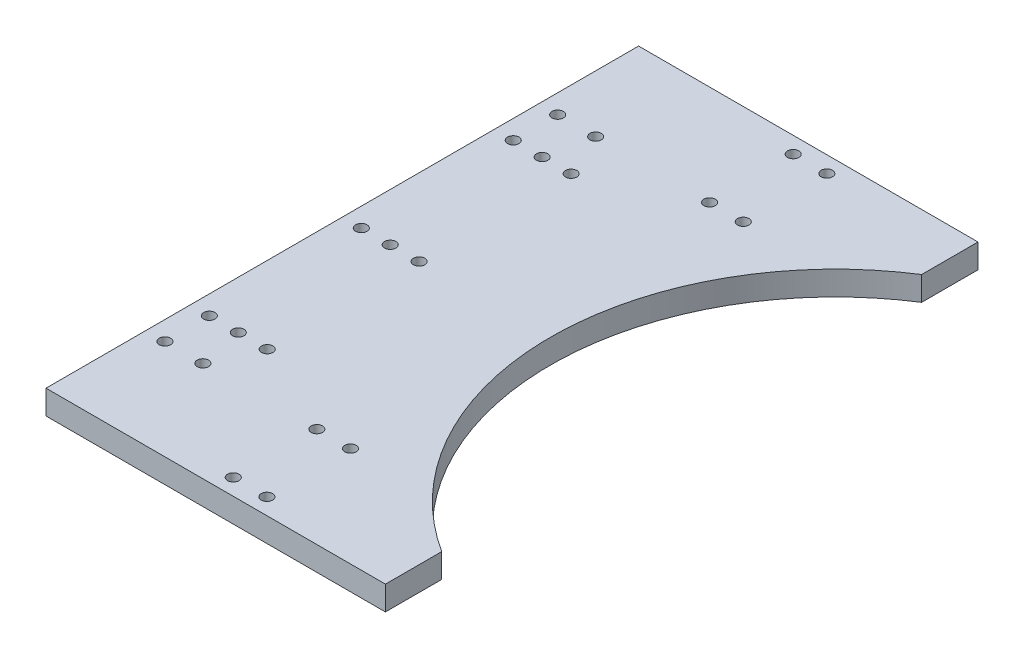
from build123d import *

# Parameters (mm, degrees)
SKETCH1_R           = 1.5
BOSS_EXTRUDE1_DEPTH = 6.35


with BuildPart() as part:
    # Sketch1 → Boss-Extrude1 (new body)
    with BuildSketch(Plane(origin=(0, 0, 0), x_dir=(1, 0, 0), z_dir=(0, 1, 0))):
        with BuildLine():
            Line((0, 0), (49.85, 0))
            Line((49.85, 0), (57.85, 0))
            Line((57.85, 0), (89.35, 0))
            Line((89.35, 0), (89.35, 14.83))
            ThreePointArc((89.35, 14.83), (54.779581991, 78), (89.35, 141.17))
            Line((89.35, 141.17), (89.35, 156))
            Line((89.35, 156), (57.85, 156))
            Line((57.85, 156), (49.85, 156))
            Line((49.85, 156), (0, 156))
            Line((0, 156), (0, 124.7))
            Line((0, 124.7), (0, 31.3))
            Line((0, 31.3), (0, 0))
        make_face()
        with Locations(Location((45, 26.3, 0), (0, 0, 270))):
            Circle(SKETCH1_R, mode=Mode.SUBTRACT)
        with Locations(Location((45, 4.3, 0), (0, 0, 270))):
            Circle(SKETCH1_R, mode=Mode.SUBTRACT)
        with Locations(Location((15, 26.3, 0), (0, 0, 270))):
            Circle(SKETCH1_R, mode=Mode.SUBTRACT)
        with Locations(Location((5, 26.3, 0), (0, 0, 270))):
            Circle(SKETCH1_R, mode=Mode.SUBTRACT)
        with Locations(Location((53.85, 26.3, 0), (0, 0, 270))):
            Circle(SKETCH1_R, mode=Mode.SUBTRACT)
        with Locations(Location((53.85, 4.3, 0), (0, 0, 270))):
            Circle(SKETCH1_R, mode=Mode.SUBTRACT)
        with Locations(Location((53.85, 151.7, 0), (0, 0, 90))):
            Circle(SKETCH1_R, mode=Mode.SUBTRACT)
        with Locations(Location((53.85, 129.7, 0), (0, 0, 90))):
            Circle(SKETCH1_R, mode=Mode.SUBTRACT)
        with Locations(Location((5, 129.7, 0), (0, 0, 90))):
            Circle(SKETCH1_R, mode=Mode.SUBTRACT)
        with Locations(Location((15, 129.7, 0), (0, 0, 90))):
            Circle(SKETCH1_R, mode=Mode.SUBTRACT)
        with Locations(Location((45, 151.7, 0), (0, 0, 90))):
            Circle(SKETCH1_R, mode=Mode.SUBTRACT)
        with Locations(Location((45, 129.7, 0), (0, 0, 90))):
            Circle(SKETCH1_R, mode=Mode.SUBTRACT)
        with Locations(Location((5, 118, 0), (0, 0, 270))):
            Circle(SKETCH1_R, mode=Mode.SUBTRACT)
        with Locations(Location((5, 78, 0), (0, 0, 270))):
            Circle(SKETCH1_R, mode=Mode.SUBTRACT)
        with Locations(Location((5, 38, 0), (0, 0, 90))):
            Circle(SKETCH1_R, mode=Mode.SUBTRACT)
        with Locations(Location((12.62, 38, 0), (0, 0, 90))):
            Circle(SKETCH1_R, mode=Mode.SUBTRACT)
        with Locations(Location((12.62, 78, 0), (0, 0, 270))):
            Circle(SKETCH1_R, mode=Mode.SUBTRACT)
        with Locations(Location((12.62, 118, 0), (0, 0, 270))):
            Circle(SKETCH1_R, mode=Mode.SUBTRACT)
        with Locations(Location((20.24, 38, 0), (0, 0, 90))):
            Circle(SKETCH1_R, mode=Mode.SUBTRACT)
        with Locations(Location((20.24, 78, 0), (0, 0, 270))):
            Circle(SKETCH1_R, mode=Mode.SUBTRACT)
        with Locations(Location((20.24, 118, 0), (0, 0, 270))):
            Circle(SKETCH1_R, mode=Mode.SUBTRACT)
    extrude(amount=BOSS_EXTRUDE1_DEPTH)


solid = part.part
